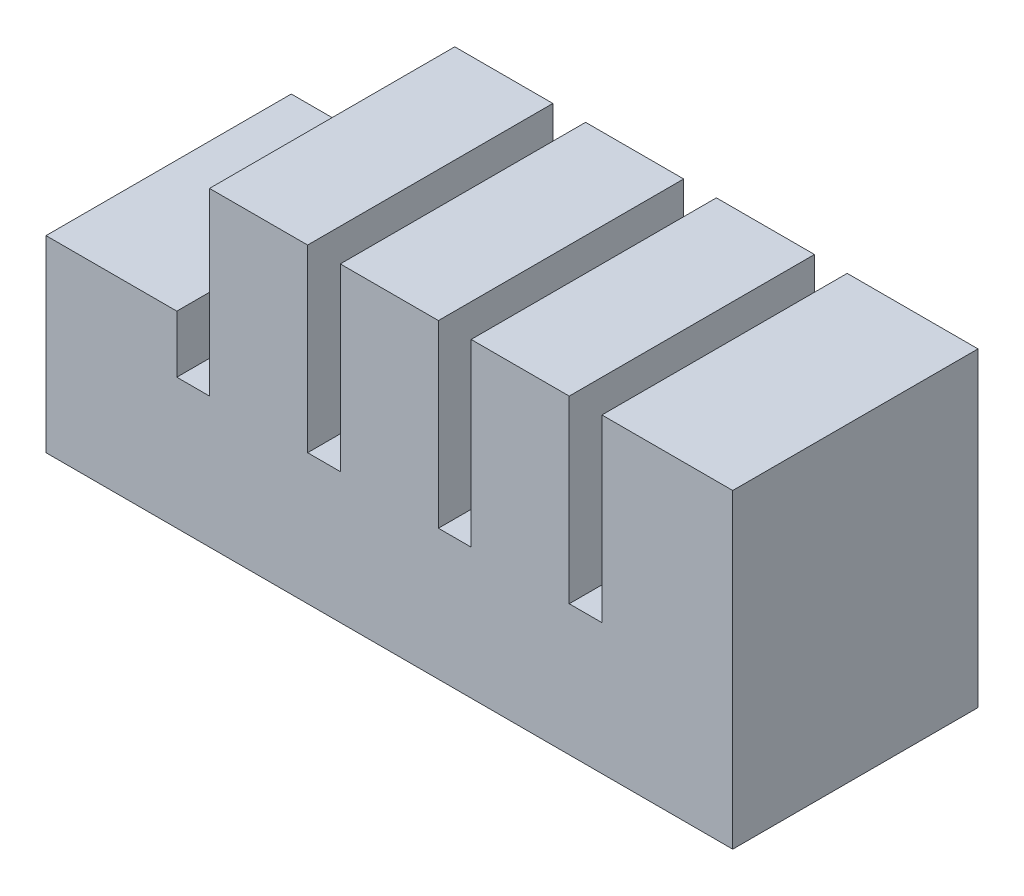
from build123d import *

# Parameters (mm, degrees)
SKETCH1_W           = 6
SKETCH1_H           = 15
BOSS_EXTRUDE1_DEPTH = 15
SKETCH2_W           = 4
SKETCH2_H           = 11
CUT_EXTRUDE1_DEPTH  = 13
SKETCH3_W           = 15
SKETCH3_H           = 4
BOSS_EXTRUDE2_DEPTH = 2
LPATTERN1_COUNT     = 4
LPATTERN1_PITCH     = 8
SKETCH4_W           = 15
SKETCH4_H           = 15
BOSS_EXTRUDE3_DEPTH = 8
SKETCH5_W           = 4
SKETCH5_H           = 11
CUT_EXTRUDE2_DEPTH  = 5.5
SKETCH6_W           = 15
SKETCH6_H           = 15
BOSS_EXTRUDE4_DEPTH = 2
SKETCH7_W           = 36
SKETCH7_H           = 2
CUT_EXTRUDE3_DEPTH  = 2
SKETCH8_W           = 8
SKETCH8_H           = 15
CUT_EXTRUDE4_DEPTH  = 7.5
SKETCH9_W           = 42
SKETCH9_H           = 15
BOSS_EXTRUDE5_DEPTH = 4


with BuildPart() as part:
    # Sketch1 → Boss-Extrude1 (new body)
    with BuildSketch(Plane(origin=(0, 0, 0), x_dir=(1, 0, 0), z_dir=(0, 1, 0))):
        with Locations((3, 7.5)):
            Rectangle(SKETCH1_W, SKETCH1_H)
    extrude(amount=BOSS_EXTRUDE1_DEPTH)

    # Sketch2 → Cut-Extrude1 (cut)
    with BuildSketch(Plane.XZ):
        with Locations((3, -7.5)):
            Rectangle(SKETCH2_W, SKETCH2_H)
    extrude(amount=-CUT_EXTRUDE1_DEPTH, mode=Mode.SUBTRACT)

    # Sketch3 → Boss-Extrude2 (add)
    with BuildSketch(Plane.ZY):
        with Locations((-7.5, 2)):
            Rectangle(SKETCH3_W, SKETCH3_H)
    extrude(amount=BOSS_EXTRUDE2_DEPTH)


with BuildPart() as lpattern1_1:
    # LPattern1: pattern copy
    add(part.part.moved(Location(Vector(-1, 0, 0) * (1 * LPATTERN1_PITCH))))


with BuildPart() as lpattern1_2:
    # LPattern1: pattern copy
    add(part.part.moved(Location(Vector(-1, 0, 0) * (2 * LPATTERN1_PITCH))))


with BuildPart() as lpattern1_3:
    # LPattern1: pattern copy
    add(part.part.moved(Location(Vector(-1, 0, 0) * (3 * LPATTERN1_PITCH))))

    # Sketch4 → Boss-Extrude3 (add)
    with BuildSketch(Plane.ZY.offset(26)):
        with Locations((-7.5, 7.5)):
            Rectangle(SKETCH4_W, SKETCH4_H)
    extrude(amount=BOSS_EXTRUDE3_DEPTH)

    # Sketch5 → Cut-Extrude2 (cut)
    with BuildSketch(Plane.XZ):
        with Locations((-29, -7.5)):
            Rectangle(SKETCH5_W, SKETCH5_H)
    extrude(amount=-CUT_EXTRUDE2_DEPTH, mode=Mode.SUBTRACT)


with BuildPart() as lpattern1_1_1:
    add(lpattern1_1.part)

    # Combine1: union LPattern1_2, LPattern1_3, part
    add(lpattern1_2.part)
    add(lpattern1_3.part)
    add(part.part)

    # Sketch6 → Boss-Extrude4 (add)
    with BuildSketch(Plane(origin=(6, 0, 0), x_dir=(0, 0, -1), z_dir=(1, 0, 0))):
        with Locations((7.5, 7.5)):
            Rectangle(SKETCH6_W, SKETCH6_H)
    extrude(amount=BOSS_EXTRUDE4_DEPTH)

    # Sketch7 → Cut-Extrude3 (cut)
    with BuildSketch(Plane.XZ):
        with Locations((-13, -7.5)):
            Rectangle(SKETCH7_W, SKETCH7_H)
    extrude(amount=-CUT_EXTRUDE3_DEPTH, mode=Mode.SUBTRACT)

    # Sketch8 → Cut-Extrude4 (cut)
    with BuildSketch(Plane(origin=(0, 15, 0), x_dir=(1, 0, 0), z_dir=(0, 1, 0))):
        with Locations((-30, 7.5)):
            Rectangle(SKETCH8_W, SKETCH8_H)
    extrude(amount=-CUT_EXTRUDE4_DEPTH, mode=Mode.SUBTRACT)

    # Sketch9 → Boss-Extrude5 (add)
    with BuildSketch(Plane.XZ):
        with Locations((-13, -7.5)):
            Rectangle(SKETCH9_W, SKETCH9_H)
    extrude(amount=BOSS_EXTRUDE5_DEPTH)


solid = lpattern1_1_1.part
